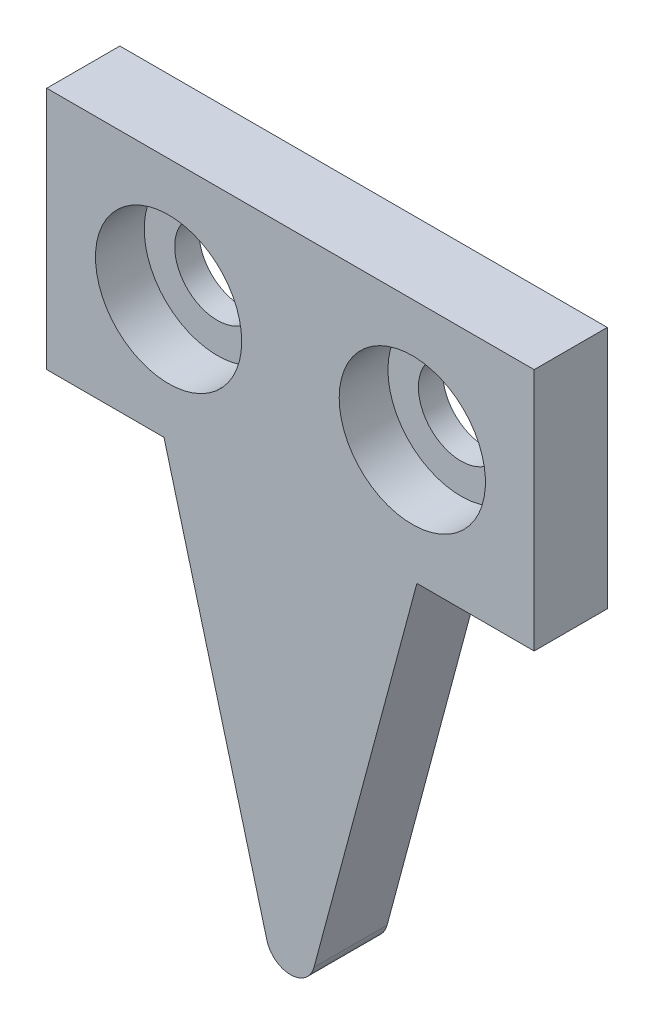
from build123d import *

# Parameters (mm, degrees)
BOSS_EXTRUDE1_DEPTH = 3
SKETCH3_R           = 1.75
CUT_EXTRUDE1_DEPTH  = 3
SKETCH5_R           = 3
CUT_EXTRUDE2_DEPTH  = 2


with BuildPart() as part:
    # Sketch2 → Boss-Extrude1 (new body)
    with BuildSketch(Plane.XY):
        with BuildLine():
            Line((-5.188488663, 15.5), (-0.965925826, -0.258819045))
            ThreePointArc((-0.965925826, -0.258819045), (0, -1), (0.965925826, -0.258819045))
            Line((0.965925826, -0.258819045), (5.188488663, 15.5))
            Line((5.188488663, 15.5), (10, 15.5))
            Line((10, 15.5), (10, 25.5))
            Line((10, 25.5), (-10, 25.5))
            Line((-10, 25.5), (-10, 15.5))
            Line((-10, 15.5), (-5.188488663, 15.5))
        make_face()
    extrude(amount=BOSS_EXTRUDE1_DEPTH)

    # Sketch3 → Cut-Extrude1 (cut)
    with BuildSketch(Plane.XY.offset(3)):
        with Locations((-5, 20.5)):
            Circle(SKETCH3_R)
        with Locations((5, 20.5)):
            Circle(SKETCH3_R)
    extrude(amount=-CUT_EXTRUDE1_DEPTH, mode=Mode.SUBTRACT)

    # Sketch5 → Cut-Extrude2 (cut)
    with BuildSketch(Plane.XY.offset(3)):
        with Locations((-5, 20.5)):
            Circle(SKETCH5_R)
        with Locations(Location((5, 20.5, 0), (0, 0, 180))):
            Circle(SKETCH5_R)
    extrude(amount=-CUT_EXTRUDE2_DEPTH, mode=Mode.SUBTRACT)


solid = part.part
